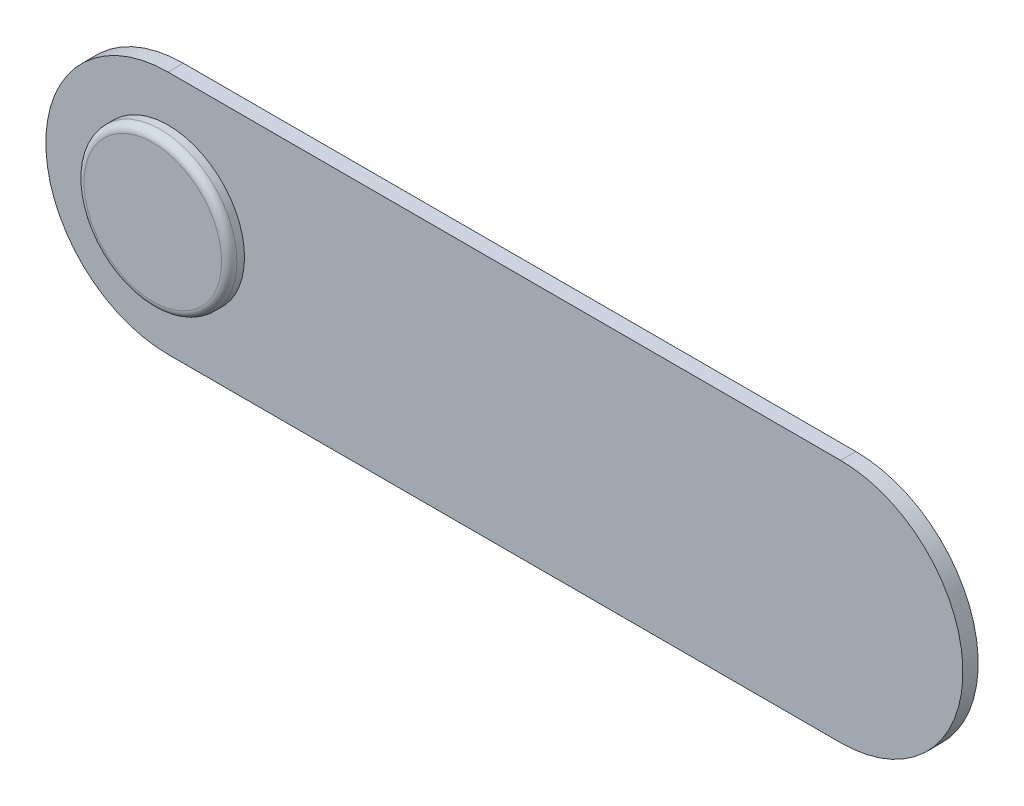
from build123d import *

# Parameters (mm, degrees)
EXTRUDE_1_DEPTH = 0.5
SKETCH_2_R      = 2.5
EXTRUDE_2_DEPTH = 0.5
FILLET_1_R      = 0.25


with BuildPart() as part:
    # 草图1 → 凸台-拉伸1 (new body)
    with BuildSketch(Plane.XY):
        with BuildLine():
            Line((0, 4), (22, 4))
            ThreePointArc((22, 4), (26, 0), (22, -4))
            Line((22, -4), (0, -4))
            ThreePointArc((0, -4), (-4, 0), (0, 4))
        make_face()
    extrude(amount=EXTRUDE_1_DEPTH)

    # 草图2 → 凸台-拉伸2 (add)
    with BuildSketch(Plane.XY.offset(0.5)):
        Circle(SKETCH_2_R)
    extrude(amount=EXTRUDE_2_DEPTH)

    # 圆角1
    fillet_1_edges = [part.edges().sort_by_distance(p)[0] for p in [
        (-2.5, 0, 1),
    ]]
    fillet(fillet_1_edges, radius=FILLET_1_R)


solid = part.part
